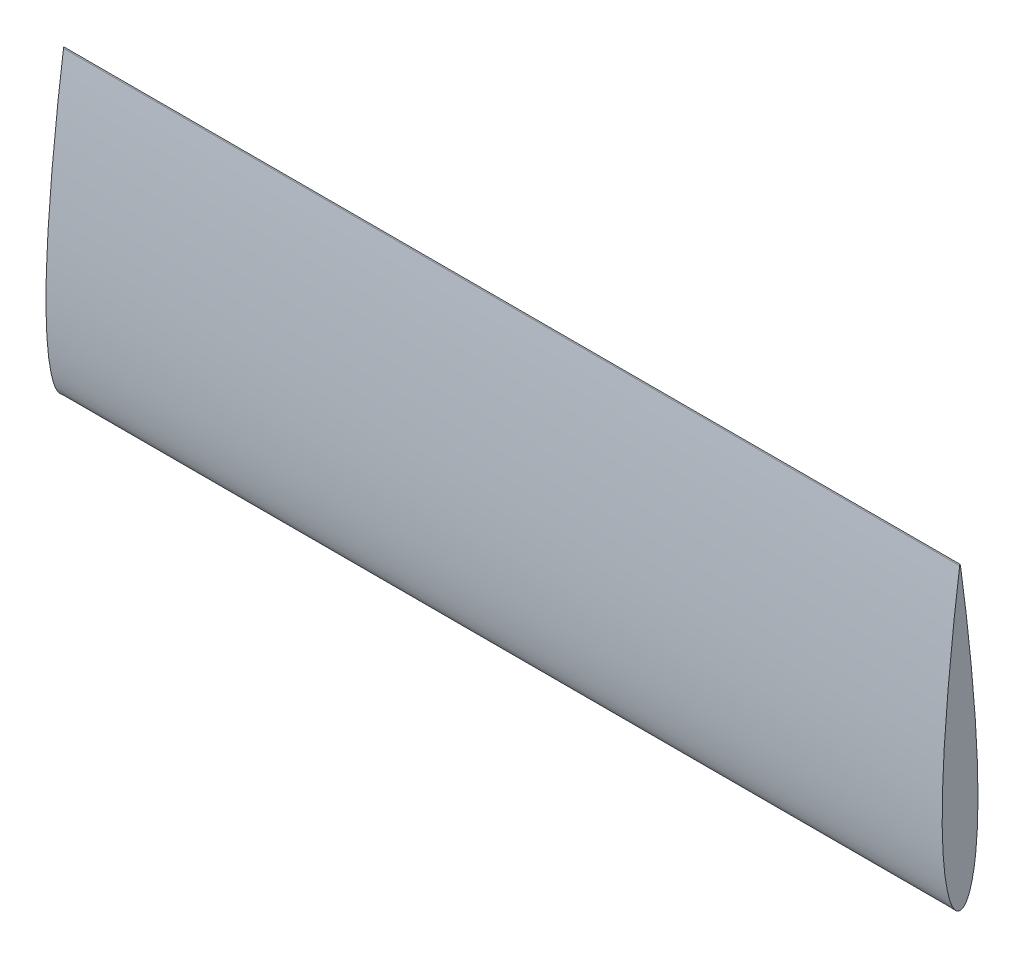
from build123d import *

# Parameters (mm, degrees)
BOSS_EXTRUDE1_DEPTH = 300


with BuildPart() as part:
    # Sketch1 → Boss-Extrude1 (new, symmetric)
    with BuildSketch(Plane(origin=(0, 0, 0), x_dir=(0, 0, -1), z_dir=(1, 0, 0))):
        with BuildLine():
            add(Edge.make_bspline(
                [(-0.252, 200), (-0.257460922, 199.961073463), (-0.279290996, 199.805464344), (-0.328259606, 199.455684465), (-0.409571381, 198.873630391), (-0.522607427, 198.060656684), (-0.666674539, 197.018663067), (-0.840827462, 195.750085835), (-1.043986935, 194.257880939), (-1.274847204, 192.54553529), (-1.532047465, 190.617049053), (-1.81396954, 188.476922374), (-2.119099046, 186.130159115), (-2.445561136, 183.582224803), (-2.791681726, 180.839083114), (-3.155523376, 177.907134899), (-3.53525219, 174.793235845), (-3.928877563, 171.504645491), (-4.334460036, 168.049053798), (-4.75000692, 164.434531839), (-5.173585811, 160.669528567), (-5.603044362, 156.762822363), (-6.189421915, 151.297968251), (-6.769451494, 145.674666781), (-7.339246363, 139.906034431), (-7.767150969, 135.433569916), (-8.18822316, 130.878355808), (-8.600099975, 126.251019671), (-9.000413005, 121.562382137), (-9.386736019, 116.823376232), (-9.756545405, 112.045077583), (-10.107366585, 107.238642718), (-10.436569886, 102.415298653), (-10.741570584, 97.586304435), (-11.019775226, 92.762937532), (-11.268599224, 87.956461019), (-11.48553584, 83.178092736), (-11.668122801, 78.43898852), (-11.814011054, 73.750217962), (-11.921069781, 69.122732447), (-11.987263909, 64.56732733), (-12.010799843, 60.094639338), (-11.990138463, 55.715111858), (-11.924044272, 51.438973701), (-11.811494111, 47.276201456), (-11.65187296, 43.23650984), (-11.44488242, 39.329330537), (-11.190476244, 35.563786307), (-10.889081571, 31.948649394), (-10.541395571, 28.492343472), (-10.148385676, 25.202927941), (-9.71145572, 22.08804748), (-9.232080753, 19.15494712), (-8.712228122, 16.410396339), (-8.153789255, 13.860739764), (-7.559058219, 11.511779461), (-6.930194054, 9.368847434), (-6.269566015, 7.4366599), (-5.57938734, 5.719340858), (-4.861712359, 4.220297265), (-4.118167887, 2.942186956), (-3.349598732, 1.886880457), (-2.555270558, 1.055914351), (-1.732393358, 0.451977281), (-0.877395637, 0.082400539), (0, -0.040167982), (0.877395637, 0.082400539), (1.732393358, 0.451977281), (2.555270558, 1.055914351), (3.349598732, 1.886880457), (4.118167887, 2.942186956), (4.861712359, 4.220297265), (5.57938734, 5.719340858), (6.269566015, 7.4366599), (6.930194054, 9.368847434), (7.559058219, 11.511779461), (8.153789255, 13.860739764), (8.712228122, 16.410396339), (9.232080753, 19.15494712), (9.71145572, 22.08804748), (10.148385676, 25.202927941), (10.541395571, 28.492343472), (10.889081571, 31.948649394), (11.190476244, 35.563786307), (11.44488242, 39.329330537), (11.65187296, 43.23650984), (11.811494111, 47.276201456), (11.924044272, 51.438973701), (11.990138463, 55.715111858), (12.010799843, 60.094639338), (11.987263909, 64.56732733), (11.921069781, 69.122732447), (11.814011054, 73.750217962), (11.668122801, 78.43898852), (11.48553584, 83.178092736), (11.268599224, 87.956461019), (11.019775226, 92.762937532), (10.741570584, 97.586304435), (10.436569886, 102.415298653), (10.107366585, 107.238642718), (9.756545405, 112.045077583), (9.386736019, 116.823376232), (9.000413005, 121.562382137), (8.600099975, 126.251019671), (8.18822316, 130.878355808), (7.632027992, 136.895347985), (6.923236247, 144.183773033), (6.189421915, 151.297968251), (5.603044362, 156.762822363), (5.173585811, 160.669528567), (4.75000692, 164.434531839), (4.334460036, 168.049053798), (3.928877563, 171.504645491), (3.53525219, 174.793235845), (3.155523376, 177.907134899), (2.791681726, 180.839083114), (2.445561136, 183.582224803), (2.119099046, 186.130159115), (1.81396954, 188.476922374), (1.532047465, 190.617049053), (1.274847204, 192.54553529), (1.043986935, 194.257880939), (0.840827462, 195.750085835), (0.666674539, 197.018663067), (0.522607427, 198.060656684), (0.409571381, 198.873630391), (0.328259606, 199.455684465), (0.280789904, 199.794757736), (0.260464608, 199.939661068), (0.256505786, 199.967881445)],
                knots=[0, 0, 0, 0, 0.000289146, 0.001155863, 0.002598059, 0.004612289, 0.007193593, 0.010335835, 0.014031413, 0.018271453, 0.023045738, 0.028342882, 0.034150137, 0.040453731, 0.047238593, 0.054488555, 0.062186438, 0.070313976, 0.078851943, 0.087780092, 0.097077362, 0.106721847, 0.116690748, 0.137507311, 0.148305913, 0.15933101, 0.170556758, 0.181956676, 0.19350401, 0.205171586, 0.216932159, 0.228757987, 0.24062146, 0.252494886, 0.264350491, 0.276160731, 0.287898257, 0.299535925, 0.311046959, 0.322405016, 0.333584241, 0.344559427, 0.355305877, 0.365799652, 0.376017633, 0.385937515, 0.395537821, 0.404798054, 0.413698797, 0.422221689, 0.430349461, 0.438066152, 0.445357166, 0.452209423, 0.458611485, 0.464554009, 0.470029938, 0.475035084, 0.479569179, 0.483636916, 0.487250222, 0.490431493, 0.493218847, 0.49567407, 0.497891229, 0.5, 0.502108771, 0.50432593, 0.506781153, 0.509568507, 0.512749778, 0.516363084, 0.520430821, 0.524964916, 0.529970062, 0.535445991, 0.541388515, 0.547790577, 0.554642834, 0.561933848, 0.569650539, 0.577778311, 0.586301203, 0.595201946, 0.604462179, 0.614062485, 0.623982367, 0.634200348, 0.644694123, 0.655440573, 0.666415759, 0.677594984, 0.688953041, 0.700464075, 0.712101743, 0.723839269, 0.735649509, 0.747505114, 0.75937854, 0.771242013, 0.783067841, 0.794828414, 0.80649599, 0.818043324, 0.829443242, 0.84066899, 0.862492689, 0.883309252, 0.893278153, 0.902922638, 0.912219908, 0.921148057, 0.929686024, 0.937813562, 0.945511445, 0.952761407, 0.959546269, 0.965849863, 0.971657118, 0.976954262, 0.981728547, 0.985968587, 0.989664165, 0.992806407, 0.995387711, 0.997401941, 0.998844137, 0.999710854, 0.999920475, 0.999920475, 0.999920475, 0.999920475], degree=3))
            add(Edge.make_bspline(
                [(-0.252, 200), (-0.225257482, 201.774256733), (0.256505786, 199.967881445)],
                knots=[0, 0, 0, 1, 1, 1], degree=2))
        make_face()
    extrude(amount=BOSS_EXTRUDE1_DEPTH, both=True)


solid = part.part
